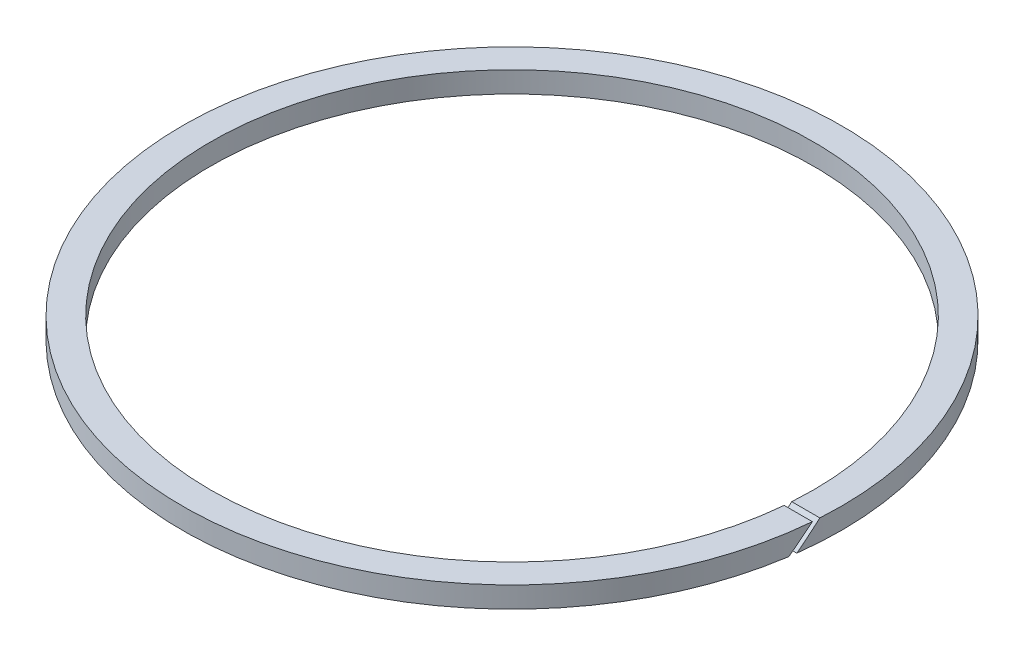
from build123d import *

# Parameters (mm, degrees)
SKETCH1_R           = 47
SKETCH1_R_2         = 43
BOSS_EXTRUDE1_DEPTH = 3
CUT_EXTRUDE1_DEPTH  = 10


with BuildPart() as part:
    # Sketch1 → Boss-Extrude1 (new body)
    with BuildSketch(Plane(origin=(0, 0, 0), x_dir=(1, 0, 0), z_dir=(0, 1, 0))):
        with Locations(Location((0, 0, 0), (0, 0, 270))):
            Circle(SKETCH1_R)
        with Locations(Location((0, 0, 0), (0, 0, 270))):
            Circle(SKETCH1_R_2, mode=Mode.SUBTRACT)
    extrude(amount=BOSS_EXTRUDE1_DEPTH)

    # Sketch3 → Cut-Extrude1 (cut)
    with BuildSketch(Plane(origin=(47, 0, 0), x_dir=(0, 0, -1), z_dir=(1, 0, 0))):
        Polygon((-4, 3), (-7, 0), (-6, 0), (-3, 3), align=None)
    extrude(amount=-CUT_EXTRUDE1_DEPTH, mode=Mode.SUBTRACT)


solid = part.part
